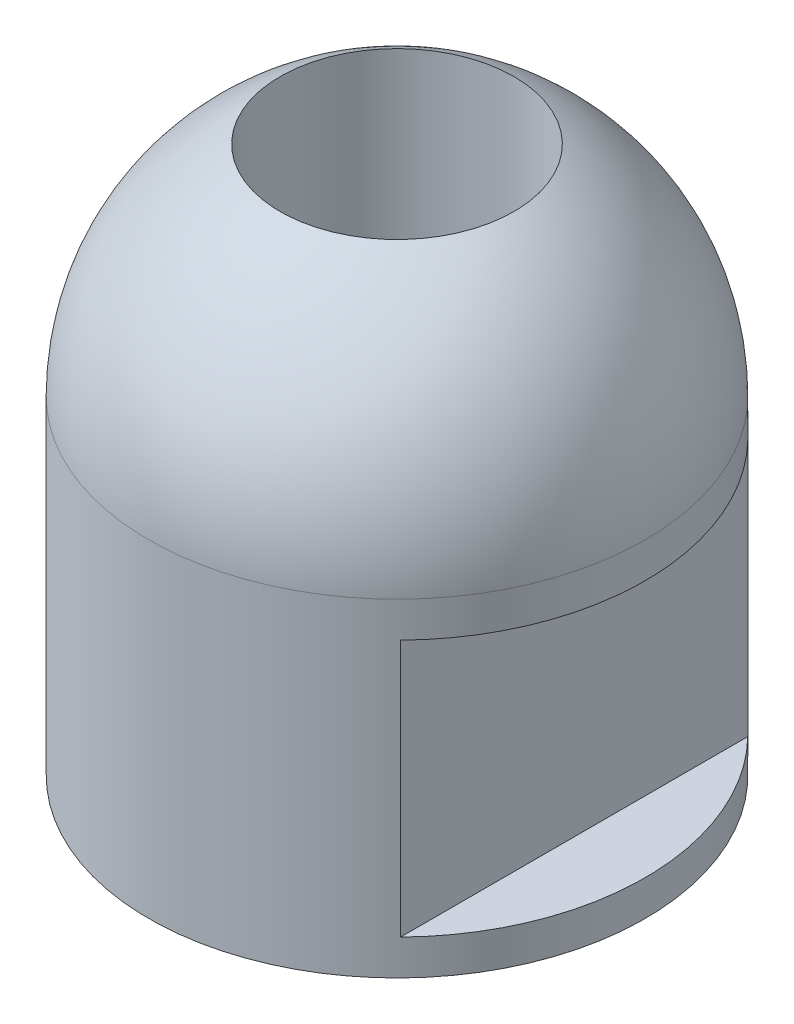
from build123d import *

# Parameters (mm, degrees)
TAP_DRILL_FOR_M4X0_7_TAP1_D = 3.3
CUT_EXTRUDE1_DEPTH          = 10.165790389
CUT_EXTRUDE1_DEPTH_BACK     = 10.165790389
SKETCH5_W                   = 1
SKETCH5_H                   = 3.627718677


with BuildPart() as part:
    # Sketch1 → Revolve1 (revolve)
    with BuildSketch(Plane.XY, mode=Mode.PRIVATE) as revolve1_sk:
        with BuildLine():
            Line((0, 0), (0, 8.127718677))
            ThreePointArc((0, 8.127718677), (2.474873734, 7.102592411), (3.5, 4.627718677))
            Line((3.5, 4.627718677), (3.5, 0))
            Line((3.5, 0), (0, 0))
        make_face()
    revolve(revolve1_sk.sketch.rotate(Axis((0, 8.127718677, 0), (0, 1, 0)), 90), axis=Axis((0, 8.127718677, 0), (0, 1, 0)))

    # Tap Drill for M4x0.7 Tap1 (through all)
    with Locations(Plane(origin=(0, 0, 0), x_dir=(-1, 0, 0), z_dir=(0, -1, 0))):
        with Locations((0, 0)):
            Hole(TAP_DRILL_FOR_M4X0_7_TAP1_D / 2)

    # Sketch5 → Cut-Extrude1 (cut, two sides: drawn at the far end of the back side and taken through both)
    with BuildSketch(Plane.XY.offset(-CUT_EXTRUDE1_DEPTH_BACK)):
        with Locations((3, 2.313859338)):
            Rectangle(SKETCH5_W, SKETCH5_H)
        with Locations((-3, 2.313859338)):
            Rectangle(SKETCH5_W, SKETCH5_H)
    extrude(amount=CUT_EXTRUDE1_DEPTH + CUT_EXTRUDE1_DEPTH_BACK, mode=Mode.SUBTRACT)


solid = part.part
